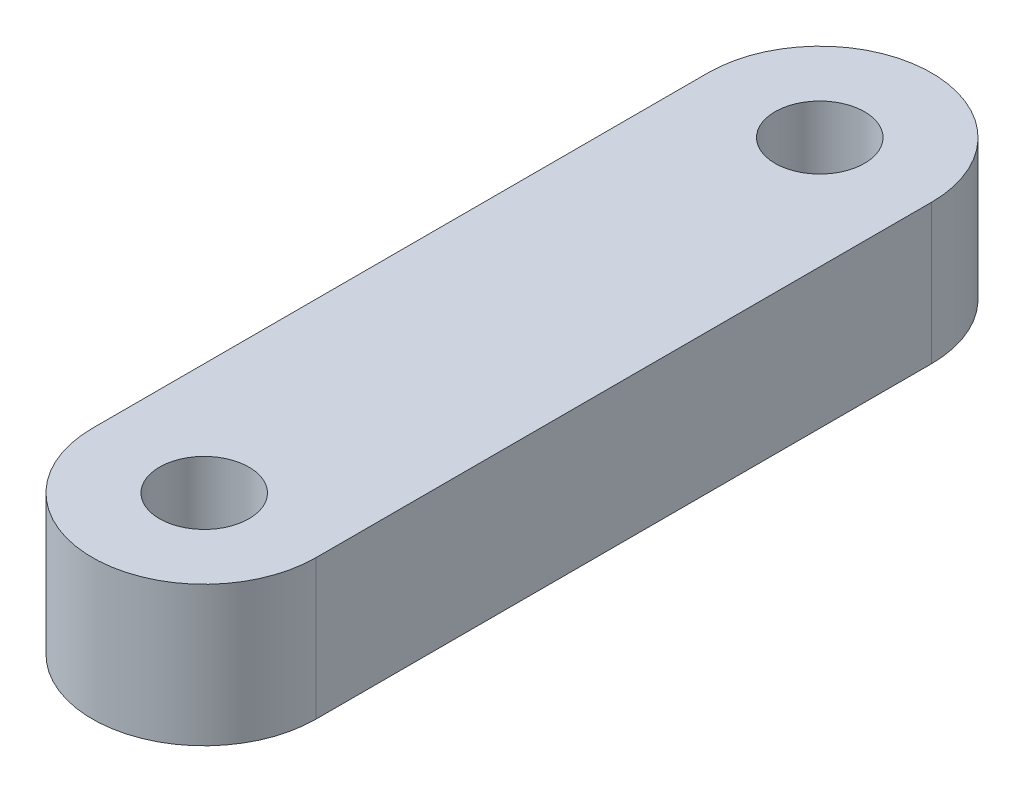
from build123d import *

# Parameters (mm, degrees)
SKETCH_1_R      = 1.6
EXTRUDE_1_DEPTH = 5


with BuildPart() as part:
    # 草图1 → 凸台-拉伸1 (new body)
    with BuildSketch(Plane(origin=(0, 0, 0), x_dir=(1, 0, 0), z_dir=(0, 1, 0))):
        with BuildLine():
            Line((-4, -11), (-4, 11))
            ThreePointArc((-4, 11), (0, 15), (4, 11))
            Line((4, 11), (4, -11))
            ThreePointArc((4, -11), (0, -15), (-4, -11))
        make_face()
        with Locations(Location((0, 11, 0), (0, 0, 270))):
            Circle(SKETCH_1_R, mode=Mode.SUBTRACT)
        with Locations(Location((0, -11, 0), (0, 0, 270))):
            Circle(SKETCH_1_R, mode=Mode.SUBTRACT)
    extrude(amount=EXTRUDE_1_DEPTH)


solid = part.part
